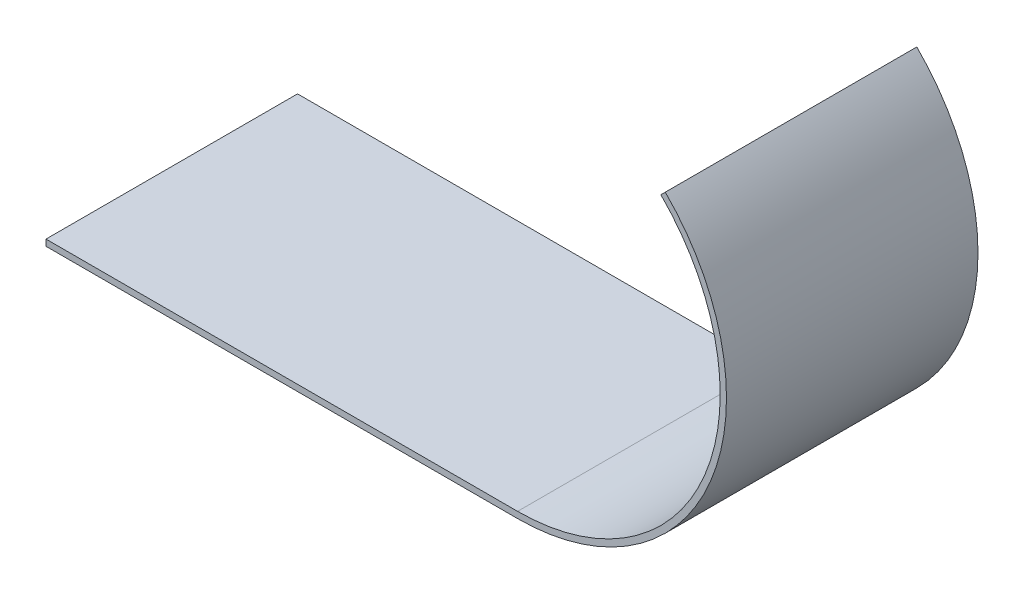
from build123d import *

# Parameters (mm, degrees)
SURFACE_EXTRUDE1_1_DEPTH = 80
THICKEN1_T2              = 2


with BuildPart() as body_1:
    # Surface-Extrude1: a surface, the sketch's curves swept straight by 80 mm
    with BuildLine(Plane.XY, mode=Mode.PRIVATE) as surface_extrude1_1_path:
        Line((0, 0), (150, 0))
        ThreePointArc((150, 0), (209.531571016, 39.777724035), (195.563491861, 110))
    surface_extrude1_1 = Shell.extrude(surface_extrude1_1_path.wire(), (0 * SURFACE_EXTRUDE1_1_DEPTH, 0 * SURFACE_EXTRUDE1_1_DEPTH, 1 * SURFACE_EXTRUDE1_1_DEPTH))
    add(Solid.thicken(surface_extrude1_1, -THICKEN1_T2))


solid = body_1.part
